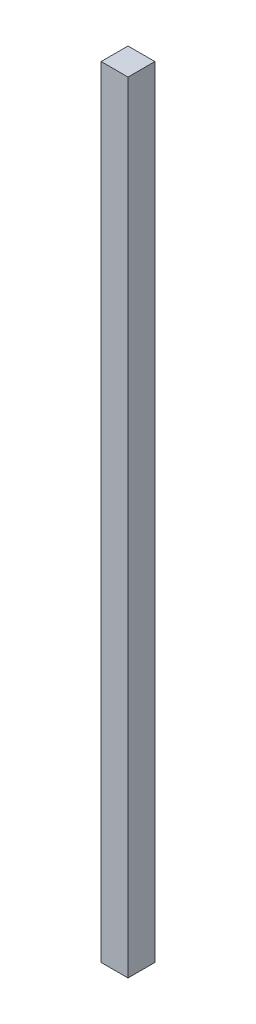
from build123d import *

# Parameters (mm, degrees)
SKETCH1_W           = 10
SKETCH1_H           = 290
BOSS_EXTRUDE1_DEPTH = 10


with BuildPart() as part:
    # Sketch1 → Boss-Extrude1 (new body)
    with BuildSketch(Plane.XY):
        with Locations((5, -145)):
            Rectangle(SKETCH1_W, SKETCH1_H)
    extrude(amount=BOSS_EXTRUDE1_DEPTH)


solid = part.part
